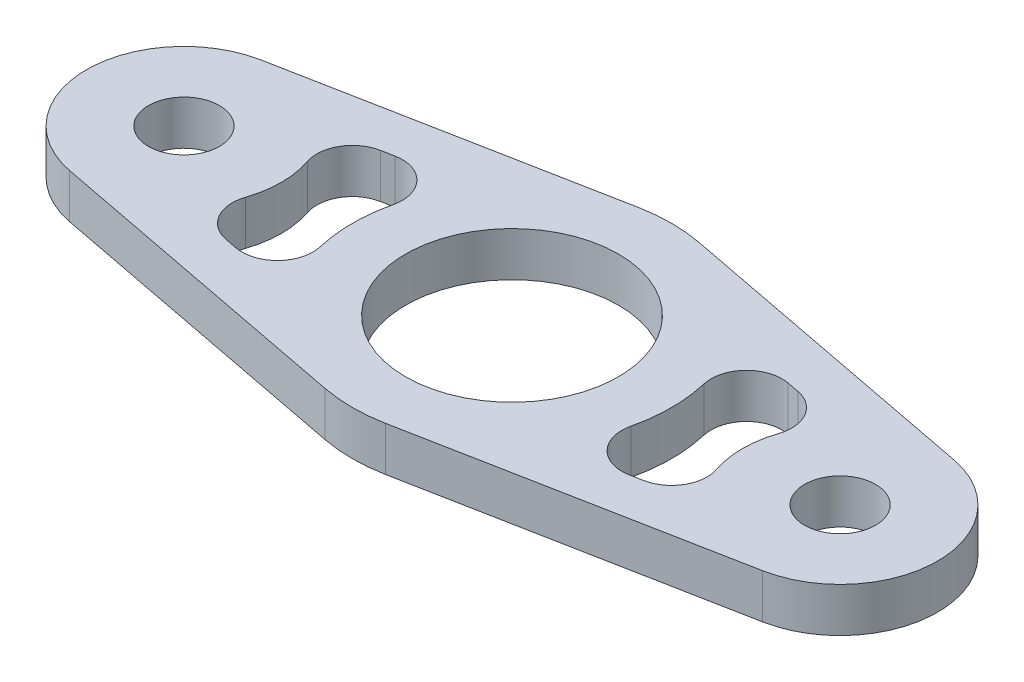
from build123d import *

# Parameters (mm, degrees)
SKETCH1_R           = 4
SKETCH1_R_2         = 12
BOSS_EXTRUDE1_DEPTH = 2.5
FILLET1_R           = 4


with BuildPart() as part:
    # Sketch1 → Boss-Extrude1 (new, symmetric)
    with BuildSketch(Plane(origin=(0, 0, 0), x_dir=(1, 0, 0), z_dir=(0, 1, 0))):
        with BuildLine():
            Line((39.081081081, 10.801347209), (3.405405405, 17.674931797))
            ThreePointArc((3.405405405, 17.674931797), (0, 18), (-3.405405405, 17.674931797))
            Line((-3.405405405, 17.674931797), (-39.081081081, 10.801347209))
            ThreePointArc((-39.081081081, 10.801347209), (-48, 0), (-39.081081081, -10.801347209))
            Line((-39.081081081, -10.801347209), (-3.405405405, -17.674931797))
            ThreePointArc((-3.405405405, -17.674931797), (0, -18), (3.405405405, -17.674931797))
            Line((3.405405405, -17.674931797), (39.081081081, -10.801347209))
            ThreePointArc((39.081081081, -10.801347209), (48, 0), (39.081081081, 10.801347209))
        make_face()
        with Locations(Location((37, 0, 0), (0, 0, 270))):
            Circle(SKETCH1_R, mode=Mode.SUBTRACT)
        with Locations(Location((-37, 0, 0), (0, 0, 270))):
            Circle(SKETCH1_R, mode=Mode.SUBTRACT)
        with Locations(Location((0, 0, 0), (0, 0, 270))):
            Circle(SKETCH1_R_2, mode=Mode.SUBTRACT)
        with BuildLine():
            Line((-29.082089608, -7.635882073), (-14.68452203, -10.40984211))
            ThreePointArc((-14.68452203, -10.40984211), (-18, 0), (-14.68452203, 10.40984211))
            Line((-14.68452203, 10.40984211), (-29.082089608, 7.635882073))
            ThreePointArc((-29.082089608, 7.635882073), (-26, 0), (-29.082089608, -7.635882073))
        make_face(mode=Mode.SUBTRACT)
        with BuildLine():
            ThreePointArc((29.082089608, -7.635882073), (26, 0), (29.082089608, 7.635882073))
            Line((29.082089608, 7.635882073), (14.68452203, 10.40984211))
            ThreePointArc((14.68452203, 10.40984211), (18, 0), (14.68452203, -10.40984211))
            Line((14.68452203, -10.40984211), (29.082089608, -7.635882073))
        make_face(mode=Mode.SUBTRACT)
    extrude(amount=BOSS_EXTRUDE1_DEPTH, both=True)

    # Fillet1
    fillet1_edges = [part.edges().sort_by_distance(p)[0] for p in [
        (29.082089608, 0, -7.635882073),
        (14.68452203, 0, -10.40984211),
        (14.68452203, 0, 10.40984211),
        (29.082089608, 0, 7.635882073),
        (-14.68452203, 0, 10.40984211),
        (-14.68452203, 0, -10.40984211),
        (-29.082089608, 0, -7.635882073),
        (-29.082089608, 0, 7.635882073),
    ]]
    fillet(fillet1_edges, radius=FILLET1_R)


solid = part.part
